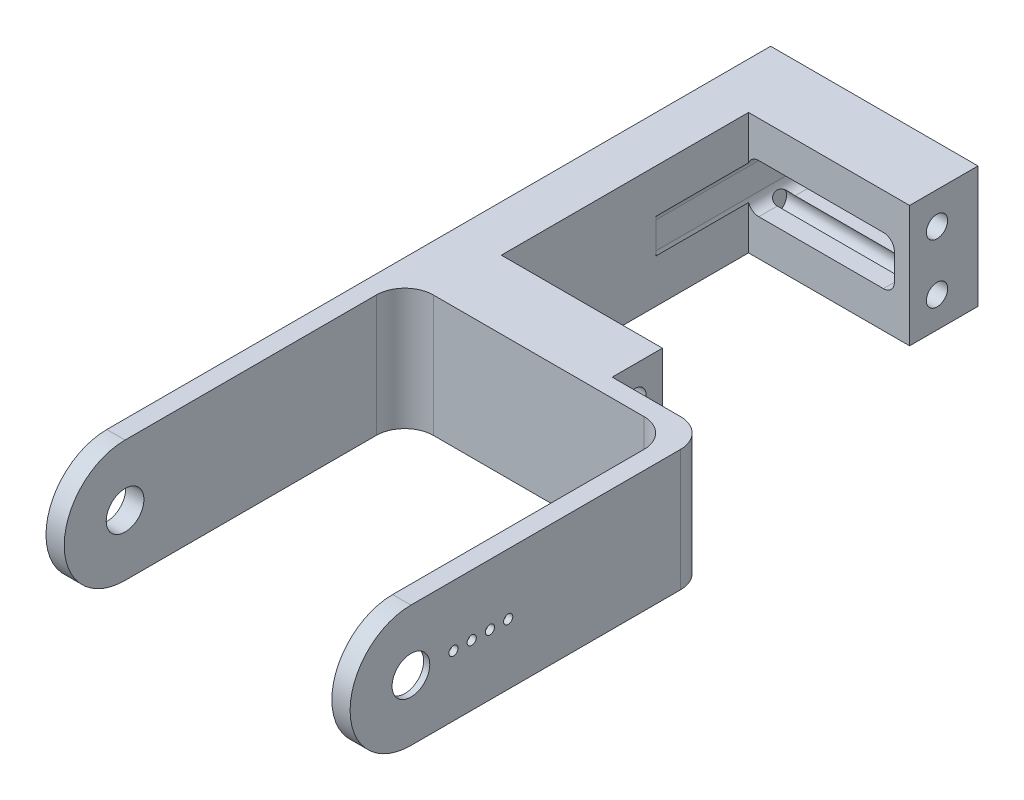
from build123d import *

# Parameters (mm, degrees)
AUFSATZ_LINEAR_AUSTRAGEN1_DEPTH      = 20
SCHNITT_LINEAR_AUSTRAGEN1_DEPTH      = 53.24
SKIZZE3_R                            = 3.1
SCHNITT_LINEAR_AUSTRAGEN2_DEPTH      = 53.24
SCHNITT_LINEAR_AUSTRAGEN3_DEPTH      = 2
SKIZZE5_R                            = 0.75
SCHNITT_LINEAR_AUSTRAGEN4_DEPTH      = 2
AUFSATZ_LINEAR_AUSTRAGEN2_DEPTH      = 20
SKIZZE7_W                            = 7.611739691
SKIZZE7_H                            = 51.890970688
AUFSATZ_LINEAR_AUSTRAGEN3_DEPTH      = 20
SKIZZE8_W                            = 11.248625368
SKIZZE8_H                            = 20
AUFSATZ_LINEAR_AUSTRAGEN4_DEPTH      = 26.48
SCHNITT_LINEAR_AUSTRAGEN5_DEPTH      = 26.48
SCHNITT_LINEAR_AUSTRAGEN6_DEPTH      = 6
SCHNITT_LINEAR_AUSTRAGEN6_DEPTH_BACK = 26.48
SKIZZE10_R                           = 1.75
SKIZZE11_R                           = 3
AUFSATZ_LINEAR_AUSTRAGEN5_DEPTH      = 6


with BuildPart() as part:
    # Skizze1 → Aufsatz-Linear austragen1 (new body)
    with BuildSketch(Plane(origin=(0, 0, 0), x_dir=(1, 0, 0), z_dir=(0, 1, 0))):
        with BuildLine():
            Line((0, 59), (0, 0))
            Line((0, 0), (3, 0))
            Line((3, 0), (3, 51.3))
            ThreePointArc((3, 51.3), (4.376598128, 54.623401872), (7.7, 56))
            Line((7.7, 56), (42.3, 56))
            ThreePointArc((42.3, 56), (45.623401872, 54.623401872), (47, 51.3))
            Line((47, 51.3), (47, 0))
            Line((47, 0), (50, 0))
            Line((50, 0), (50, 54.3))
            ThreePointArc((50, 54.3), (48.623401872, 57.623401872), (45.3, 59))
            Line((45.3, 59), (0, 59))
        make_face()
    extrude(amount=AUFSATZ_LINEAR_AUSTRAGEN1_DEPTH)

    # Skizze2 → Schnitt-Linear austragen1 (cut)
    with BuildSketch(Plane(origin=(50, 0, 0), x_dir=(0, 0, -1), z_dir=(1, 0, 0))):
        with BuildLine():
            ThreePointArc((0, 10), (2.928932188, 17.071067812), (10, 20))
            Line((10, 20), (0, 20))
            Line((0, 20), (0, 10))
        make_face()
        with BuildLine():
            ThreePointArc((10, 0), (2.928932188, 2.928932188), (0, 10))
            Line((0, 10), (0, 0))
            Line((0, 0), (10, 0))
        make_face()
    extrude(amount=-SCHNITT_LINEAR_AUSTRAGEN1_DEPTH, mode=Mode.SUBTRACT)

    # Skizze3 → Schnitt-Linear austragen2 (cut)
    with BuildSketch(Plane(origin=(50, 0, 0), x_dir=(0, 0, -1), z_dir=(1, 0, 0))):
        with Locations((10, 10)):
            Circle(SKIZZE3_R)
    extrude(amount=-SCHNITT_LINEAR_AUSTRAGEN2_DEPTH, mode=Mode.SUBTRACT)

    # Skizze4 → Schnitt-Linear austragen3 (cut)
    with BuildSketch(Plane.ZY.offset(-47)):
        with BuildLine():
            Line((-27.5, 12.5), (-14.807252725, 14.374965285))
            ThreePointArc((-14.807252725, 14.374965285), (-3.5, 10), (-14.807252725, 5.625034715))
            Line((-14.807252725, 5.625034715), (-27.5, 7.5))
            ThreePointArc((-27.5, 7.5), (-30, 10), (-27.5, 12.5))
        make_face()
    extrude(amount=-SCHNITT_LINEAR_AUSTRAGEN3_DEPTH, mode=Mode.SUBTRACT)

    # Skizze5 → Schnitt-Linear austragen4 (cut)
    with BuildSketch(Plane.ZY.offset(-49)):
        with Locations((-25.995480757, 10)):
            Circle(SKIZZE5_R)
        with Locations((-22.995480757, 10)):
            Circle(SKIZZE5_R)
        with Locations((-19.995480757, 10)):
            Circle(SKIZZE5_R)
        with Locations((-16.995480757, 10)):
            Circle(SKIZZE5_R)
    extrude(amount=-SCHNITT_LINEAR_AUSTRAGEN4_DEPTH, mode=Mode.SUBTRACT)

    # Skizze6 → Aufsatz-Linear austragen2 (add)
    with BuildSketch(Plane.XZ):
        Polygon((34.094038703, -59.256850744), (34.094038703, -67.256850744), (0, -67.256850744), (0, -59.256850744), (0, -57.894447073), (34.094038703, -57.894447073), align=None)
    extrude(amount=-AUFSATZ_LINEAR_AUSTRAGEN2_DEPTH)

    # Skizze7 → Aufsatz-Linear austragen3 (add)
    with BuildSketch(Plane.XZ):
        with Locations((3.805869846, -93.202336088)):
            Rectangle(SKIZZE7_W, SKIZZE7_H)
    extrude(amount=-AUFSATZ_LINEAR_AUSTRAGEN3_DEPTH)

    # Skizze8 → Aufsatz-Linear austragen4 (add)
    with BuildSketch(Plane(origin=(7.611739691, 0, 0), x_dir=(0, 0, -1), z_dir=(1, 0, 0))):
        with Locations((113.523508748, 10)):
            Rectangle(SKIZZE8_W, SKIZZE8_H)
    extrude(amount=AUFSATZ_LINEAR_AUSTRAGEN4_DEPTH)

    # Skizze9 → Schnitt-Linear austragen5 (cut)
    with BuildSketch(Plane(origin=(0, 0, -119.147821432), x_dir=(-1, 0, 0), z_dir=(0, 0, -1))):
        with BuildLine():
            Line((-9.3, 14), (-29.794038703, 14))
            ThreePointArc((-29.794038703, 14), (-31.066830909, 13.472792206), (-31.594038703, 12.2))
            Line((-31.594038703, 12.2), (-31.594038703, 7.8))
            ThreePointArc((-31.594038703, 7.8), (-31.066830909, 6.527207794), (-29.794038703, 6))
            Line((-29.794038703, 6), (-9.3, 6))
            ThreePointArc((-9.3, 6), (-8.027207794, 6.527207794), (-7.5, 7.8))
            Line((-7.5, 7.8), (-7.5, 12.2))
            ThreePointArc((-7.5, 12.2), (-8.027207794, 13.472792206), (-9.3, 14))
        make_face()
    extrude(amount=-SCHNITT_LINEAR_AUSTRAGEN5_DEPTH, mode=Mode.SUBTRACT)

    # Skizze10 → Schnitt-Linear austragen6 (cut, two sides: drawn at the far end of the back side and taken through both)
    with BuildSketch(Plane(origin=(34.091739691, 0, 0), x_dir=(0, 0, -1), z_dir=(1, 0, 0)).offset(-SCHNITT_LINEAR_AUSTRAGEN6_DEPTH_BACK)):
        with Locations((62.806850744, 14.75)):
            Circle(SKIZZE10_R)
        with Locations((62.806850744, 5.05)):
            Circle(SKIZZE10_R)
        with Locations(Location((112.406850744, 5.05, 0), (0, 0, 180))):
            Circle(SKIZZE10_R)
        with Locations(Location((112.406850744, 14.75, 0), (0, 0, 180))):
            Circle(SKIZZE10_R)
    extrude(amount=SCHNITT_LINEAR_AUSTRAGEN6_DEPTH + SCHNITT_LINEAR_AUSTRAGEN6_DEPTH_BACK, mode=Mode.SUBTRACT)

    # Skizze11 → Aufsatz-Linear austragen5 (add)
    with BuildSketch(Plane.ZY):
        with Locations((-99.456850744, 9.9)):
            Circle(SKIZZE11_R)
    extrude(amount=AUFSATZ_LINEAR_AUSTRAGEN5_DEPTH)


solid = part.part
